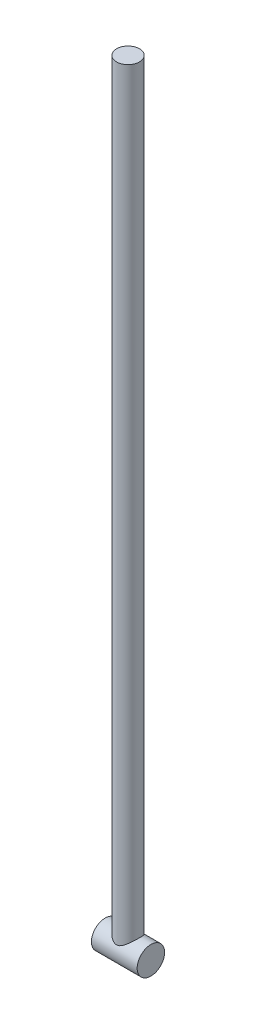
from build123d import *

# Parameters (mm, degrees)
SKETCH1_W = 63.5
SKETCH1_H = 4287.774
SKETCH2_W = 254
SKETCH2_H = 76.2


with BuildPart() as part:
    # Sketch1 → Revolve1 (revolve)
    with BuildSketch(Plane.XY, mode=Mode.PRIVATE) as revolve1_sk:
        with Locations((31.75, 2143.887)):
            Rectangle(SKETCH1_W, SKETCH1_H)
    revolve(revolve1_sk.sketch.rotate(Axis((0, 4287.774, 0), (0, -1, 0)), 180), axis=Axis((0, 4287.774, 0), (0, -1, 0)))

    # Sketch2 → Revolve2 (revolve)
    with BuildSketch(Plane.XY, mode=Mode.PRIVATE) as revolve2_sk:
        with Locations((0, 38.1)):
            Rectangle(SKETCH2_W, SKETCH2_H)
    revolve(revolve2_sk.sketch.rotate(Axis((-127, 0, 0), (1, 0, 0)), 90), axis=Axis((-127, 0, 0), (1, 0, 0)))


solid = part.part
